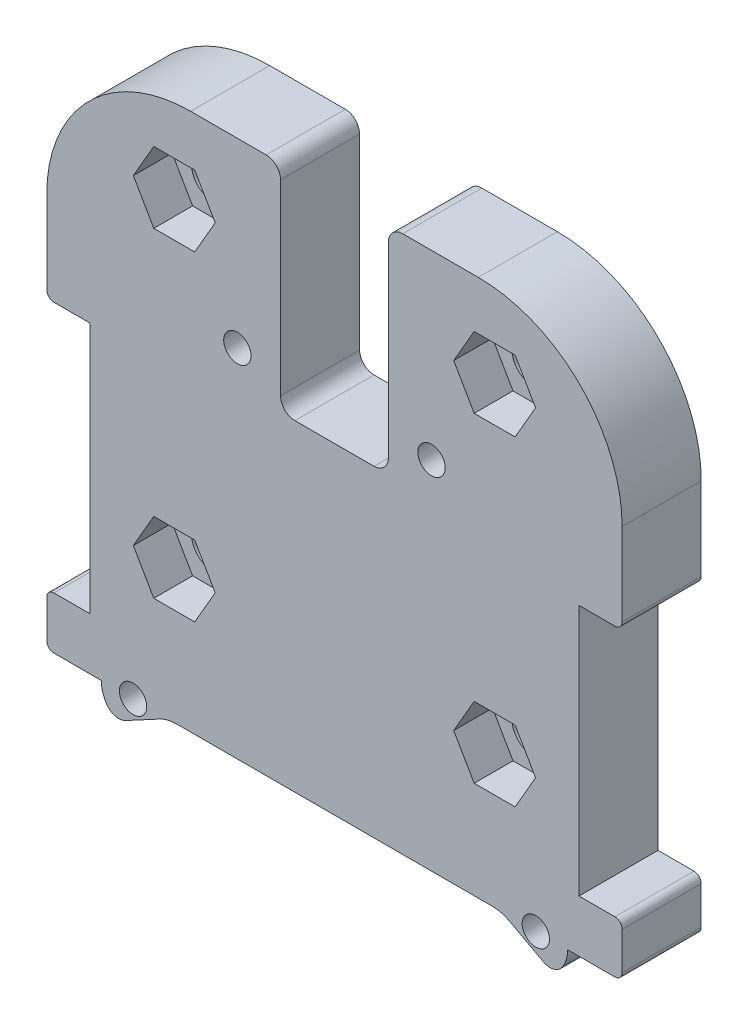
from build123d import *

# Parameters (mm, degrees)
SKETCH_1_W                   = 80
SKETCH_1_H                   = 100
EXTRUDE_1_DEPTH              = 11
SKETCH_7_W                   = 15
SKETCH_7_H                   = 30
CUT_EXTRUDE_1_DEPTH          = 16
HOLE_WIZARD_M4_1_D           = 3.3
HOLE_WIZARD_M4_1_CSINK_D     = 4.05
HOLE_WIZARD_M4_1_CSINK_ANGLE = 90
FILLET_1_R                   = 20
FILLET_2_R                   = 2
SKETCH_9_W                   = 6
SKETCH_9_H                   = 35
CUT_EXTRUDE_2_DEPTH          = 11
SKETCH_11_R                  = 3
CUT_EXTRUDE_4_DEPTH          = 15
SKETCH_12_R                  = 3.43
CUT_EXTRUDE_5_DEPTH          = 3.9
CUT_EXTRUDE_6_DEPTH          = 5.4
CUT_EXTRUDE_7_DEPTH          = 14
SKETCH_15_R                  = 1.9
CUT_EXTRUDE_8_DEPTH          = 14
FILLET_4_R                   = 0.12
FILLET_5_R                   = 1


with BuildPart() as part:
    # 草图1 → 凸台-拉伸1 (new body)
    with BuildSketch(Plane.XY):
        Rectangle(SKETCH_1_W, SKETCH_1_H)
    extrude(amount=EXTRUDE_1_DEPTH)

    # 草图7 → 切除-拉伸1 (cut)
    with BuildSketch(Plane.XY.offset(11)):
        with Locations((0, 35)):
            Rectangle(SKETCH_7_W, SKETCH_7_H)
    extrude(amount=-CUT_EXTRUDE_1_DEPTH, mode=Mode.SUBTRACT)

    # M4 螺纹孔1 (through all)
    with Locations(Plane(origin=(13.5, 24.75, 0), x_dir=(-1, 0, 0), z_dir=(0, 0, -1))):
        with Locations((0, 0), (27, 0), (41.5, -49.5), (-14.5, -49.5)):
            CounterSinkHole(HOLE_WIZARD_M4_1_D / 2, HOLE_WIZARD_M4_1_CSINK_D / 2, counter_sink_angle=HOLE_WIZARD_M4_1_CSINK_ANGLE)

    # 圆角1
    fillet_1_edges = [part.edges().sort_by_distance(p)[0] for p in [
        (-40, 50, 5.5),
        (40, 50, 5.5),
    ]]
    fillet(fillet_1_edges, radius=FILLET_1_R)

    # 圆角2
    fillet_2_edges = [part.edges().sort_by_distance(p)[0] for p in [
        (-7.5, 20, 5.5),
        (-7.5, 50, 5.5),
        (7.5, 50, 5.5),
        (7.5, 20, 5.5),
        (40, -50, 5.5),
        (-40, -50, 5.5),
    ]]
    fillet(fillet_2_edges, radius=FILLET_2_R)

    # 草图9 → 切除-拉伸2 (cut)
    with BuildSketch(Plane.XY):
        with Locations((37, 0)):
            Rectangle(SKETCH_9_W, SKETCH_9_H)
        with Locations((-37, 0)):
            Rectangle(SKETCH_9_W, SKETCH_9_H)
    extrude(amount=CUT_EXTRUDE_2_DEPTH, mode=Mode.SUBTRACT)

    # 草图11 → 切除-拉伸4 (cut)
    with BuildSketch(Plane.XY):
        with Locations((-22.273863607, 38.273863607)):
            Circle(SKETCH_11_R)
        with Locations((22.273863607, 38.273863607)):
            Circle(SKETCH_11_R)
        with Locations((22.273863607, -6.273863607)):
            Circle(SKETCH_11_R)
        with Locations((-22.273863607, -6.273863607)):
            Circle(SKETCH_11_R)
    extrude(amount=CUT_EXTRUDE_4_DEPTH, mode=Mode.SUBTRACT)

    # 草图12 → 切除-拉伸5 (cut)
    with BuildSketch(Plane.XY):
        with Locations((13.5, 24.75)):
            Circle(SKETCH_12_R)
        with Locations((28, -24.75)):
            Circle(SKETCH_12_R)
        with Locations(Location((-28, -24.75, 0), (0, 0, 180))):
            Circle(SKETCH_12_R)
        with Locations(Location((-13.5, 24.75, 0), (0, 0, 180))):
            Circle(SKETCH_12_R)
    extrude(amount=CUT_EXTRUDE_5_DEPTH, mode=Mode.SUBTRACT)

    # 草图13 → 切除-拉伸6 (cut)
    with BuildSketch(Plane.XY.offset(11)):
        Polygon((-19.42752678, 33.343863607), (-16.581189953, 38.273863607), (-19.42752678, 43.203863607), (-25.120200434, 43.203863607), (-27.966537262, 38.273863607), (-25.120200434, 33.343863607), align=None)
        Polygon((-19.42752678, -11.203863607), (-16.581189953, -6.273863607), (-19.42752678, -1.343863607), (-25.120200434, -1.343863607), (-27.966537262, -6.273863607), (-25.120200434, -11.203863607), align=None)
        Polygon((25.120200434, -11.203863607), (19.42752678, -11.203863607), (16.581189953, -6.273863607), (19.42752678, -1.343863607), (25.120200434, -1.343863607), (27.966537262, -6.273863607), align=None)
        Polygon((25.120200434, 33.343863607), (19.42752678, 33.343863607), (16.581189953, 38.273863607), (19.42752678, 43.203863607), (25.120200434, 43.203863607), (27.966537262, 38.273863607), align=None)
    extrude(amount=-CUT_EXTRUDE_6_DEPTH, mode=Mode.SUBTRACT)

    # 草图14 → 切除-拉伸7 (cut)
    with BuildSketch(Plane(origin=(0, 0, 0), x_dir=(-1, 0, 0), z_dir=(0, 0, -1))):
        with BuildLine():
            Line((-42.281489137, -24.75), (-32.43, -24.75))
            ThreePointArc((-32.43, -24.75), (-32.229391744, -26.068008147), (-31.645735677, -27.266646852))
            ThreePointArc((-31.645735677, -27.266646852), (-30.468858677, -28.074682546), (-29.053003561, -27.892157349))
            Line((-29.053003561, -27.892157349), (-24.314984036, -25.345764556))
            ThreePointArc((-24.314984036, -25.345764556), (-23.168394001, -24.901228134), (-21.947979567, -24.75))
            Line((-21.947979567, -24.75), (21.947979567, -24.75))
            ThreePointArc((21.947979567, -24.75), (23.168394001, -24.901228134), (24.314984036, -25.345764556))
            Line((24.314984036, -25.345764556), (29.053003561, -27.892157349))
            ThreePointArc((29.053003561, -27.892157349), (30.468858677, -28.074682546), (31.645735677, -27.266646852))
            ThreePointArc((31.645735677, -27.266646852), (32.229391744, -26.068008147), (32.43, -24.75))
            Line((32.43, -24.75), (45.771408099, -24.75))
            Line((45.771408099, -24.75), (45.771408099, -58.548543379))
            Line((45.771408099, -58.548543379), (-42.281489137, -58.548543379))
            Line((-42.281489137, -58.548543379), (-42.281489137, -24.75))
        make_face()
    extrude(amount=-CUT_EXTRUDE_7_DEPTH, mode=Mode.SUBTRACT)

    # 草图15 → 切除-拉伸8 (cut)
    with BuildSketch(Plane.XY.offset(11)):
        with Locations((-13.5, 24.75)):
            Circle(SKETCH_15_R)
        with Locations((-28, -24.75)):
            Circle(SKETCH_15_R)
        with Locations((13.5, 24.75)):
            Circle(SKETCH_15_R)
        with Locations((28, -24.75)):
            Circle(SKETCH_15_R)
    extrude(amount=-CUT_EXTRUDE_8_DEPTH, mode=Mode.SUBTRACT)

    # 圆角4
    fillet_4_edges = [part.edges().sort_by_distance(p)[0] for p in [
        (24.660163825, -25.531277369, 1.95),
        (29.199579974, -27.963395071, 1.95),
        (-29.199579974, -27.963395071, 1.95),
        (-24.660163825, -25.531277369, 1.95),
    ]]
    fillet(fillet_4_edges, radius=FILLET_4_R)

    # 圆角5
    fillet_5_edges = [part.edges().sort_by_distance(p)[0] for p in [
        (40, -17.5, 5.5),
        (40, 17.5, 5.5),
        (-40, 17.5, 5.5),
        (-40, -17.5, 5.5),
        (40, -24.75, 5.5),
        (-40, -24.75, 5.5),
    ]]
    fillet(fillet_5_edges, radius=FILLET_5_R)


solid = part.part
